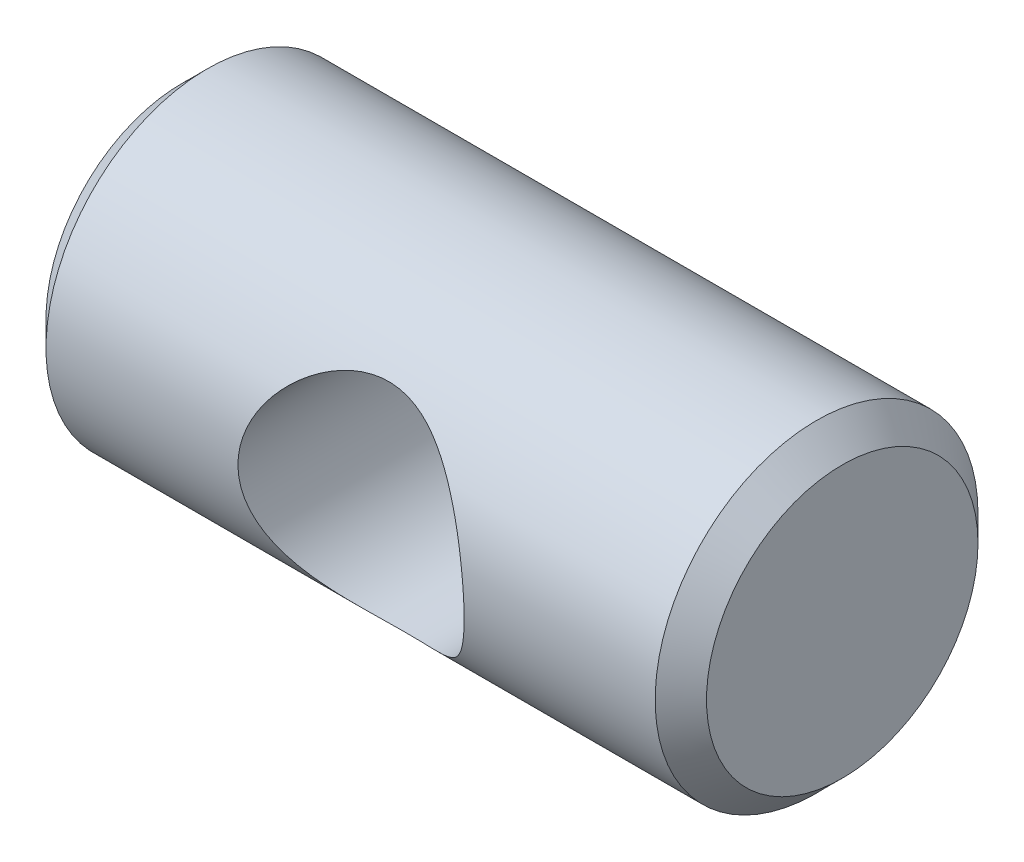
from build123d import *

# Parameters (mm, degrees)
SKETCH1_R               = 4.78
BOSS_EXTRUDE1_DEPTH     = 9.78
CUT_EXTRUDE1_DEPTH      = 12.888868743
CUT_EXTRUDE1_DEPTH_BACK = 12.888868743
SKETCH3_R               = 3.34
CHAMFER1_SIZE           = 0.76


with BuildPart() as part:
    # Sketch1 → Boss-Extrude1 (new, symmetric)
    with BuildSketch(Plane(origin=(0, 0, 0), x_dir=(0, 0, -1), z_dir=(1, 0, 0))):
        Circle(SKETCH1_R)
    extrude(amount=BOSS_EXTRUDE1_DEPTH, both=True)

    # Sketch3 → Cut-Extrude1 (cut, two sides: drawn at the far end of the back side and taken through both)
    with BuildSketch(Plane.XY.offset(-CUT_EXTRUDE1_DEPTH_BACK)):
        with Locations(Location((0, -0.25, 0), (0, 0, 4.292620915))):
            Circle(SKETCH3_R)
    extrude(amount=CUT_EXTRUDE1_DEPTH + CUT_EXTRUDE1_DEPTH_BACK, mode=Mode.SUBTRACT)

    # Chamfer1
    chamfer1_edges = [part.edges().sort_by_distance(p)[0] for p in [
        (-9.78, 0, 4.78),
        (9.78, 0, 4.78),
    ]]
    chamfer(chamfer1_edges, length=CHAMFER1_SIZE)


solid = part.part
